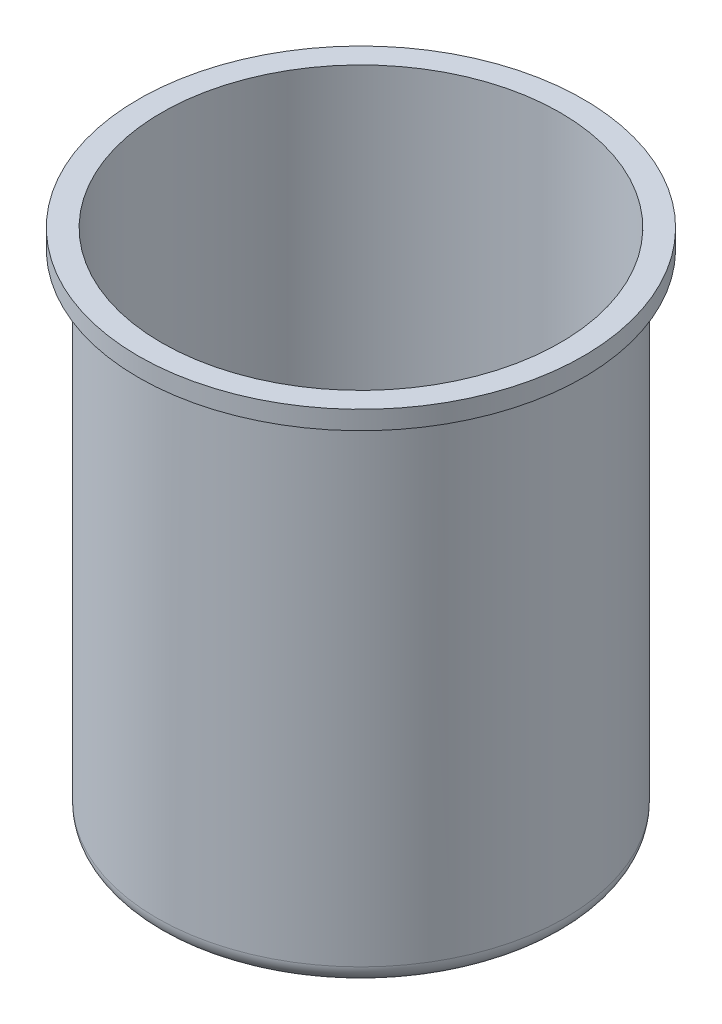
from build123d import *
from build123d.topology import SkipClean

# Parameters (mm, degrees)
SKETCH1_R           = 279.4
BOSS_EXTRUDE3_DEPTH = 12.7
SKETCH2_R           = 279.4
BOSS_EXTRUDE6_DEPTH = 692.15
SKETCH8_R           = 273.05
BOSS_EXTRUDE7_DEPTH = 623.57
SKETCH10_R          = 273.05
CUT_EXTRUDE1_DEPTH  = 623.57
FILLET1_R           = 25.4
FILLET2_R           = 2.54
SKETCH11_R          = 304.8
BOSS_EXTRUDE8_DEPTH = 25.4
SKETCH12_R          = 273.05
CUT_EXTRUDE6_DEPTH  = 25.4
SKETCH13_R          = 292.1
SKETCH13_R_2        = 279.4
CUT_EXTRUDE11_DEPTH = 12.7


with BuildPart() as part:
    # Sketch1 → Boss-Extrude3 (new body)
    with BuildSketch(Plane(origin=(0, 0, 0), x_dir=(1, 0, 0), z_dir=(0, 1, 0))):
        with Locations(Location((0, 0, 0), (0, 0, 270))):
            Circle(SKETCH1_R)
    extrude(amount=BOSS_EXTRUDE3_DEPTH)

    # Sketch2 → Boss-Extrude6 (add)
    with BuildSketch(Plane(origin=(0, 12.7, 0), x_dir=(1, 0, 0), z_dir=(0, 1, 0))):
        with Locations(Location((0, 0, 0), (0, 0, 270))):
            Circle(SKETCH2_R)
    extrude(amount=BOSS_EXTRUDE6_DEPTH)

    # Sketch8 → Boss-Extrude7 (add)
    with BuildSketch(Plane(origin=(0, 704.85, 0), x_dir=(1, 0, 0), z_dir=(0, 1, 0))):
        Circle(SKETCH8_R)
    extrude(amount=-BOSS_EXTRUDE7_DEPTH)

    # Sketch10 → Cut-Extrude1 (cut)
    with BuildSketch(Plane(origin=(0, 704.85, 0), x_dir=(1, 0, 0), z_dir=(0, 1, 0))):
        with Locations(Location((0, 0, 0), (0, 0, 270))):
            Circle(SKETCH10_R)
    extrude(amount=-CUT_EXTRUDE1_DEPTH, mode=Mode.SUBTRACT)

    # Fillet1
    fillet1_edges = [part.edges().sort_by_distance(p)[0] for p in [
        (0, 0, -279.4),
    ]]
    fillet(fillet1_edges, radius=FILLET1_R)

    # Fillet2
    fillet2_edges = [part.edges().sort_by_distance(p)[0] for p in [
        (0, 704.85, -273.05),
        (0, 704.85, -279.4),
    ]]
    fillet(fillet2_edges, radius=FILLET2_R)

    # Sketch11 → Boss-Extrude8 (add)
    with BuildSketch(Plane(origin=(0, 704.85, 0), x_dir=(1, 0, 0), z_dir=(0, 1, 0))):
        with Locations(Location((0, 0, 0), (0, 0, 270))):
            Circle(SKETCH11_R)
    extrude(amount=-BOSS_EXTRUDE8_DEPTH)

    # Sketch12 → Cut-Extrude6 (cut)
    with BuildSketch(Plane(origin=(0, 704.85, 0), x_dir=(1, 0, 0), z_dir=(0, 1, 0))):
        with Locations(Location((0, 0, 0), (0, 0, 270))):
            Circle(SKETCH12_R)
    extrude(amount=-CUT_EXTRUDE6_DEPTH, mode=Mode.SUBTRACT)

    # Sketch13 → Cut-Extrude11 (cut)
    with SkipClean():  # the faces are left unmerged after this step: merging them gives an invalid solid
        with BuildSketch(Plane(origin=(0, 679.45, 0), x_dir=(-1, 0, 0), z_dir=(0, -1, 0))):
            with Locations(Location((0, 0, 0), (0, 0, 90))):
                Circle(SKETCH13_R)
            with Locations(Location((0, 0, 0), (0, 0, 90))):
                Circle(SKETCH13_R_2, mode=Mode.SUBTRACT)
        extrude(amount=-CUT_EXTRUDE11_DEPTH, mode=Mode.SUBTRACT)


solid = part.part
